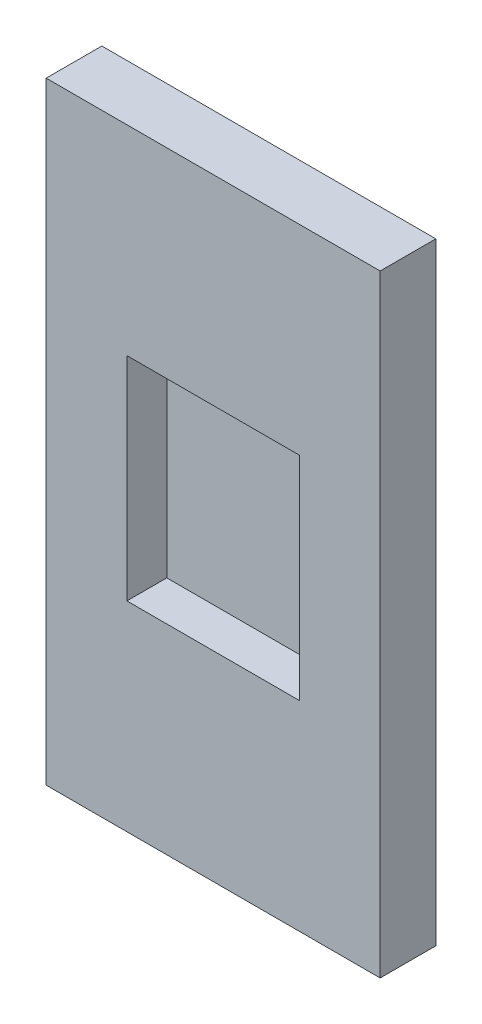
from build123d import *

# Parameters (mm, degrees)
SKETCH_1_W          = 18
SKETCH_1_H          = 33
EXTRUDE_1_DEPTH     = 3
SKETCH_2_W          = 9.3
SKETCH_2_H          = 11.45
CUT_EXTRUDE_1_DEPTH = 2.15


with BuildPart() as part:
    # 스케치1 → 보스-돌출1 (new body)
    with BuildSketch(Plane.XY):
        Rectangle(SKETCH_1_W, SKETCH_1_H)
    extrude(amount=EXTRUDE_1_DEPTH)

    # 스케치2 → 컷-돌출1 (cut)
    with BuildSketch(Plane.XY.offset(3)):
        Rectangle(SKETCH_2_W, SKETCH_2_H)
    extrude(amount=-CUT_EXTRUDE_1_DEPTH, mode=Mode.SUBTRACT)


solid = part.part
